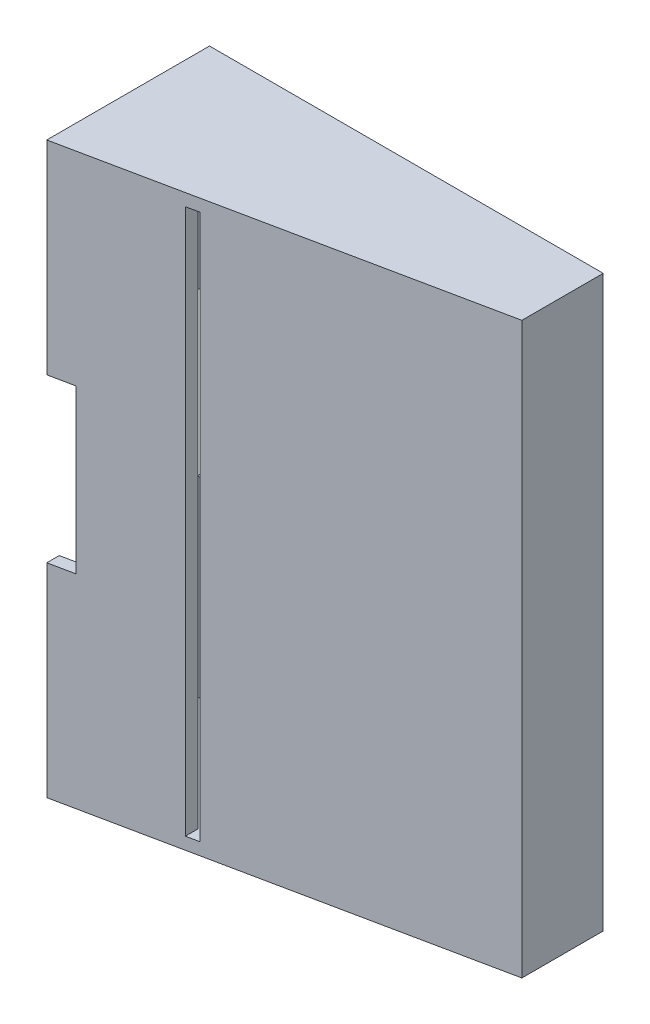
from build123d import *

# Parameters (mm, degrees)
SKETCH1_W                      = 2.9
SKETCH1_H                      = 19.8
BOSS_EXTRUDE1_DEPTH            = 1.5
SKETCH2_W                      = 22.5
SKETCH2_H                      = 25.8
BOSS_EXTRUDE3_DEPTH            = 1.5
BOSS_EXTRUDE4_DEPTH            = 20
CUT_EXTRUDE1_DEPTH             = 70
CUT_EXTRUDE2_START             = -35
CUT_EXTRUDE2_DEPTH             = 33.5
CUT_EXTRUDE3_REACH             = 80.554
SKETCH6_W                      = 1.5
SKETCH6_H                      = 67
CUT_EXTRUDE3_DIRECTION_2_DEPTH = 1.5


with BuildPart() as part:
    # Sketch1 → Boss-Extrude1 (new body)
    with BuildSketch(Plane.XY):
        with Locations((-45.437495374, 25.25)):
            Rectangle(SKETCH1_W, SKETCH1_H)
    extrude(amount=-BOSS_EXTRUDE1_DEPTH)

    # Sketch2 → Boss-Extrude3 (add)
    with BuildSketch(Plane(origin=(0, 0, -1.5), x_dir=(-1, 0, 0), z_dir=(0, 0, -1))):
        with Locations((35.637495374, 25.25)):
            Rectangle(SKETCH2_W, SKETCH2_H)
    extrude(amount=BOSS_EXTRUDE3_DEPTH)


with BuildPart() as body_2:
    # Sketch3 → Boss-Extrude4 (new body)
    with BuildSketch(Plane.XY):
        Polygon((-46.887495374, 35.25), (-43.887495374, 35.25), (-43.887495374, 15.25), (-46.887495374, 15.25), (-46.887495374, -9.75), (1.5, -9.75), (1.5, 60.25), (-46.887495374, 60.25), align=None)
    extrude(amount=BOSS_EXTRUDE4_DEPTH)

    # Sketch4 → Cut-Extrude1 (cut)
    with BuildSketch(Plane.XZ.offset(9.75)):
        Polygon((1.5, 20), (-46.887495374, 20), (1.5, 10), align=None)
    extrude(amount=-CUT_EXTRUDE1_DEPTH, mode=Mode.SUBTRACT)

    # Sketch5 → Cut-Extrude2 (cut)
    with BuildSketch(Plane.XZ.offset(9.75).offset(CUT_EXTRUDE2_START)):
        Polygon((-45.387495374, 18.158304667), (-45.387495374, 1.5), (0, 1.5), (0, 8.778299559), align=None)
        Polygon((-46.887495374, 1.5), (-45.387495374, 1.5), (-45.387495374, 18.158304667), (-46.887495374, 18.468302113), align=None)
    cut_extrude2 = extrude(amount=CUT_EXTRUDE2_DEPTH, mode=Mode.SUBTRACT)

    # Mirror1: Cut-Extrude2 across plane
    add(cut_extrude2.mirror(Plane.ZX.offset(25.25)), mode=Mode.SUBTRACT)

    # Cut-Extrude3: up to this plane
    cut_extrude3_end = Plane(origin=(2.043439135, 60.251, 9.887690171), z_dir=(-0.20238811385577932, 0, -0.9793053922908319))
    # Sketch6 → Cut-Extrude3 (cut, up to the surface)
    with BuildSketch(Plane(origin=(0, 0, 1.5), x_dir=(-1, 0, 0), z_dir=(0, 0, -1)), mode=Mode.PRIVATE) as cut_extrude3_sk1:
        with Locations((32.02, 25.25)):
            Rectangle(SKETCH6_W, SKETCH6_H)
    cut_extrude3_tool1 = split(extrude(cut_extrude3_sk1.sketch, amount=-CUT_EXTRUDE3_REACH, mode=Mode.PRIVATE), bisect_by=cut_extrude3_end, keep=Keep.BOTH, mode=Mode.PRIVATE)
    add(cut_extrude3_tool1.solids().sort_by_distance((-32.02, 25.25, 1.5))[0], mode=Mode.SUBTRACT)

    # Sketch6 → Cut-Extrude3 direction 2 (cut)
    with BuildSketch(Plane(origin=(0, 0, 1.5), x_dir=(-1, 0, 0), z_dir=(0, 0, -1))):
        with Locations((32.02, 25.25)):
            Rectangle(SKETCH6_W, SKETCH6_H)
    extrude(amount=CUT_EXTRUDE3_DIRECTION_2_DEPTH, mode=Mode.SUBTRACT)


solid = Compound([part.part, body_2.part])
